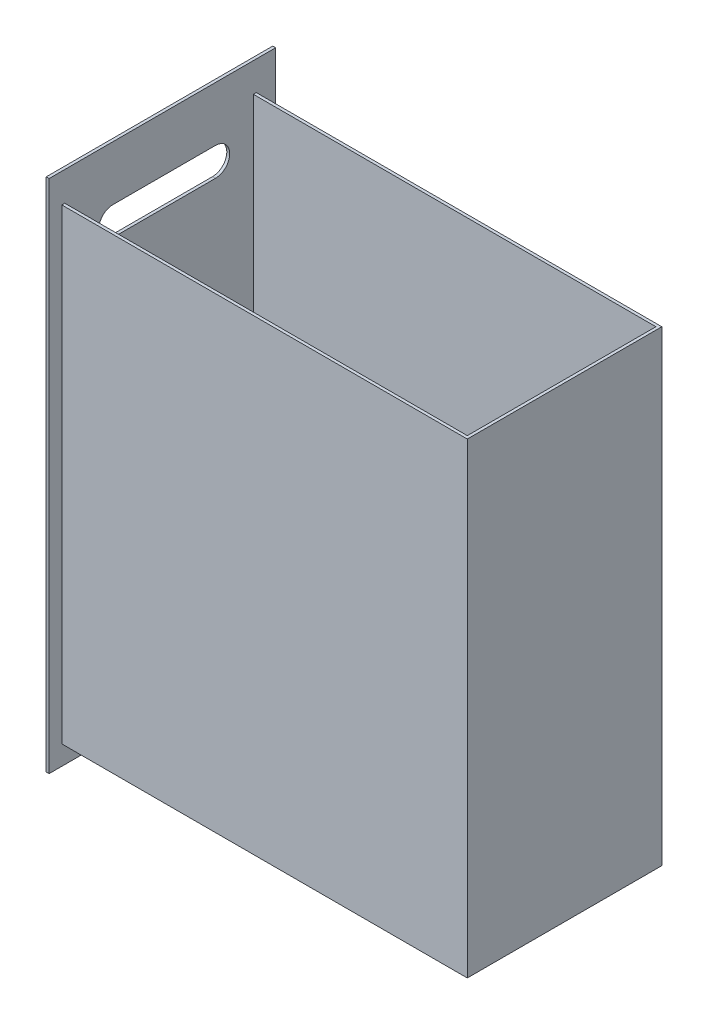
from build123d import *

# Parameters (mm, degrees)
SKETCH_1_W          = 420
SKETCH_1_H          = 200
EXTRUDE_1_DEPTH     = 3
SKETCH_2_W          = 420
SKETCH_2_H          = 200
SKETCH_2_W_2        = 414
SKETCH_2_H_2        = 194
EXTRUDE_1_2_DEPTH   = 477
SKETCH_4_W          = 233
SKETCH_4_H          = 530
EXTRUDE_2_DEPTH     = 3
CUT_EXTRUDE_1_DEPTH = 3


with BuildPart() as part:
    # 草图1 → Extrude 1 (new body)
    with BuildSketch(Plane(origin=(0, 0, 0), x_dir=(1, 0, 0), z_dir=(0, 1, 0))):
        Rectangle(SKETCH_1_W, SKETCH_1_H)
    extrude(amount=EXTRUDE_1_DEPTH)

    # 草图2 → Extrude 1 2 (add)
    with BuildSketch(Plane(origin=(0, 3, 0), x_dir=(1, 0, 0), z_dir=(0, 1, 0))):
        Rectangle(SKETCH_2_W, SKETCH_2_H)
        Rectangle(SKETCH_2_W_2, SKETCH_2_H_2, mode=Mode.SUBTRACT)
    extrude(amount=EXTRUDE_1_2_DEPTH)

    # 草图4 → 凸台-拉伸2 (add)
    with BuildSketch(Plane.ZY.offset(210)):
        with Locations((-3.5, 245)):
            Rectangle(SKETCH_4_W, SKETCH_4_H)
    extrude(amount=-EXTRUDE_2_DEPTH)

    # 草图5 → 切除-拉伸1 (cut)
    with BuildSketch(Plane.ZY.offset(210)):
        with BuildLine():
            Line((-58.054561009, 453.925202317), (47.32277396, 453.925202317))
            ThreePointArc((47.32277396, 453.925202317), (61.958514928, 439.289461349), (47.32277396, 424.653720381))
            Line((47.32277396, 424.653720381), (-58.054561009, 424.653720381))
            ThreePointArc((-58.054561009, 424.653720381), (-72.690301977, 439.289461349), (-58.054561009, 453.925202317))
        make_face()
    extrude(amount=-CUT_EXTRUDE_1_DEPTH, mode=Mode.SUBTRACT)


solid = part.part
